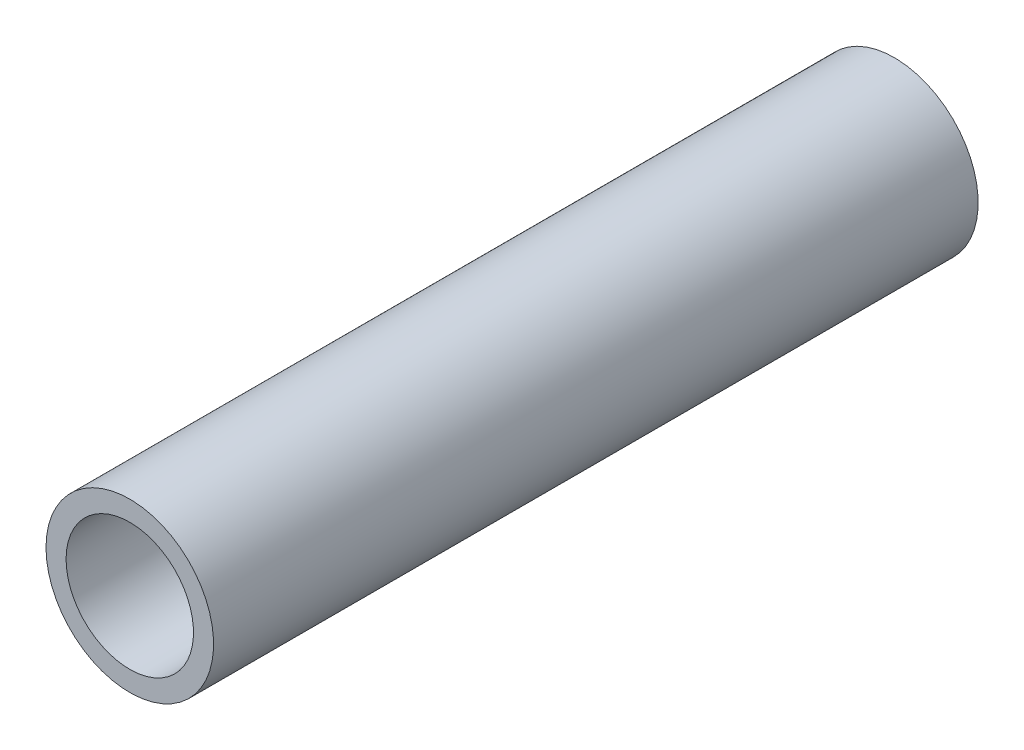
from build123d import *

# Parameters (mm, degrees)
SKETCH1_R           = 16.7005
SKETCH1_R_2         = 12.7
BOSS_EXTRUDE1_DEPTH = 152.4


with BuildPart() as part:
    # Sketch1 → Boss-Extrude1 (new body)
    with BuildSketch(Plane.XY):
        with Locations(Location((0, 0, 0), (0, 0, 180))):
            Circle(SKETCH1_R)
        with Locations(Location((0, 0, 0), (0, 0, 180))):
            Circle(SKETCH1_R_2, mode=Mode.SUBTRACT)
    extrude(amount=BOSS_EXTRUDE1_DEPTH)


solid = part.part
